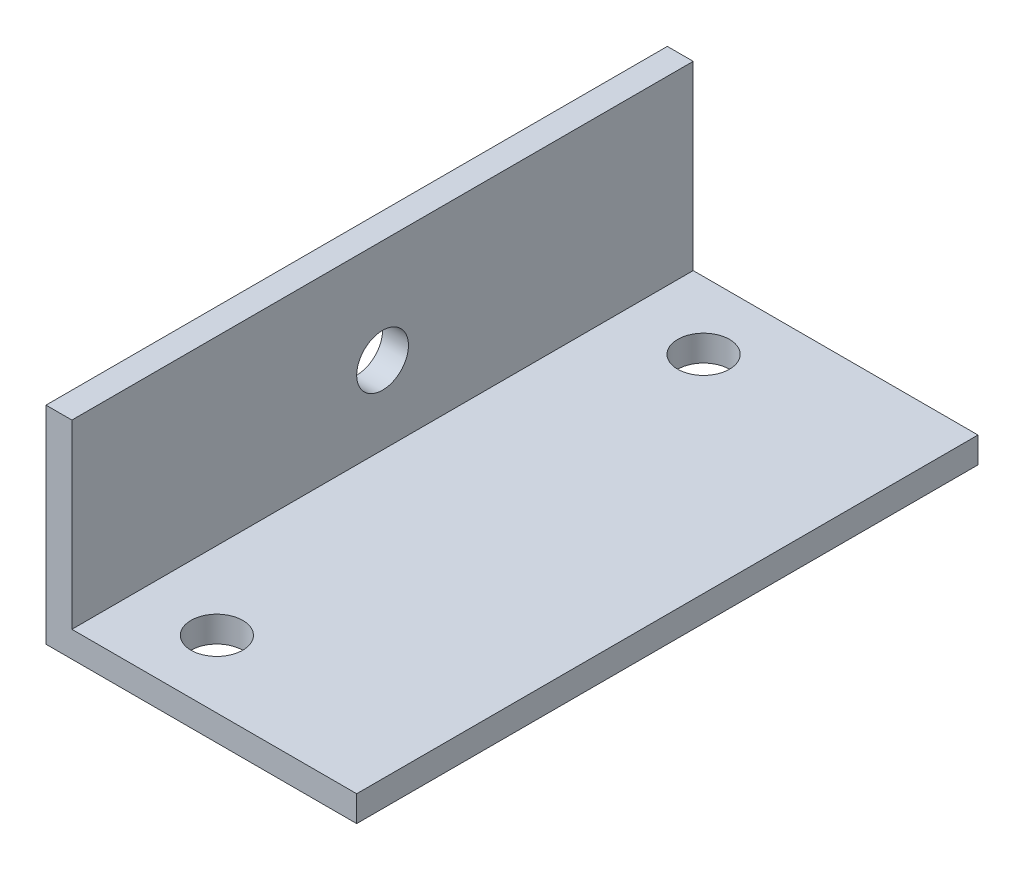
from build123d import *

# Parameters (mm, degrees)
BOSS_EXTRUDE1_DEPTH = 38.1
SKETCH2_R           = 1.5875
CUT_EXTRUDE1_DEPTH  = 45.45
SKETCH3_R           = 1.5875
CUT_EXTRUDE2_DEPTH  = 45.45


with BuildPart() as part:
    # Sketch1 → Boss-Extrude1 (new body)
    with BuildSketch(Plane.XY):
        Polygon((0, 12.7), (0, 0), (19.05, 0), (19.05, 1.5875), (1.5875, 1.5875), (1.5875, 12.7), align=None)
    extrude(amount=BOSS_EXTRUDE1_DEPTH)

    # Sketch2 → Cut-Extrude1 (cut, through all)
    with BuildSketch(Plane.ZY):
        with Locations(Location((19.05, 6.35, 0), (0, 0, 270))):
            Circle(SKETCH2_R)
    extrude(amount=-CUT_EXTRUDE1_DEPTH, mode=Mode.SUBTRACT)

    # Sketch3 → Cut-Extrude2 (cut, through all)
    with BuildSketch(Plane.XZ):
        with Locations(Location((6.35, 4.1275, 0), (0, 0, 270))):
            Circle(SKETCH3_R)
        with Locations(Location((6.35, 33.9725, 0), (0, 0, 270))):
            Circle(SKETCH3_R)
    extrude(amount=-CUT_EXTRUDE2_DEPTH, mode=Mode.SUBTRACT)


solid = part.part
